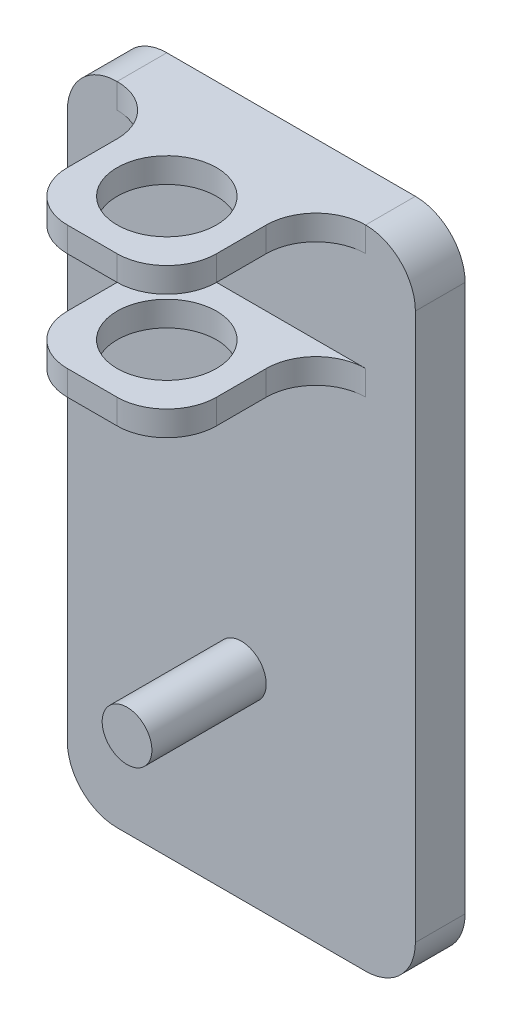
from build123d import *

# Parameters (mm, degrees)
CROQUIS1_W              = 70
CROQUIS1_H              = 130
SALIENTE_EXTRUIR1_DEPTH = 5
REDONDEO1_R             = 10
CROQUIS2_R              = 5
SALIENTE_EXTRUIR3_DEPTH = 23
CROQUIS3_W              = 30
CROQUIS3_H              = 5
SALIENTE_EXTRUIR4_DEPTH = 30
CROQUIS5_R              = 10
CORTAR_EXTRUIR2_DEPTH   = 112.579568022
REDONDEO2_R             = 10
REDONDEO3_R             = 10


with BuildPart() as part:
    # Croquis1 → Saliente-Extruir1 (new, symmetric)
    with BuildSketch(Plane.XY):
        Rectangle(CROQUIS1_W, CROQUIS1_H)
    extrude(amount=SALIENTE_EXTRUIR1_DEPTH, both=True)

    # Redondeo1
    redondeo1_edges = [part.edges().sort_by_distance(p)[0] for p in [
        (35, -65, 0),
        (-35, -65, 0),
        (-35, 65, 0),
        (35, 65, 0),
    ]]
    fillet(redondeo1_edges, radius=REDONDEO1_R)

    # Croquis2 → Saliente-Extruir3 (add)
    with BuildSketch(Plane.XY.offset(5)):
        with Locations((0, -25)):
            Circle(CROQUIS2_R)
    extrude(amount=SALIENTE_EXTRUIR3_DEPTH)

    # Croquis3 → Saliente-Extruir4 (add)
    with BuildSketch(Plane.XY.offset(35)):
        with Locations((0, 62.5)):
            Rectangle(CROQUIS3_W, CROQUIS3_H)
        with Locations((0, 37.5)):
            Rectangle(CROQUIS3_W, CROQUIS3_H)
    extrude(amount=-SALIENTE_EXTRUIR4_DEPTH)

    # Croquis5 → Cortar-Extruir2 (cut, through all)
    with BuildSketch(Plane.XZ.offset(-35)):
        with Locations(Location((0, 20, 0), (0, 0, 270))):
            Circle(CROQUIS5_R)
    extrude(amount=-CORTAR_EXTRUIR2_DEPTH, mode=Mode.SUBTRACT)

    # Redondeo2
    redondeo2_edges = [part.edges().sort_by_distance(p)[0] for p in [
        (-15, 62.5, 5),
        (-15, 62.5, 35),
        (15, 62.5, 5),
        (15, 62.5, 35),
    ]]
    fillet(redondeo2_edges, radius=REDONDEO2_R)

    # Redondeo3
    redondeo3_edges = [part.edges().sort_by_distance(p)[0] for p in [
        (-15, 37.5, 5),
        (15, 37.5, 5),
        (-15, 37.5, 35),
        (15, 37.5, 35),
    ]]
    fillet(redondeo3_edges, radius=REDONDEO3_R)


solid = part.part
